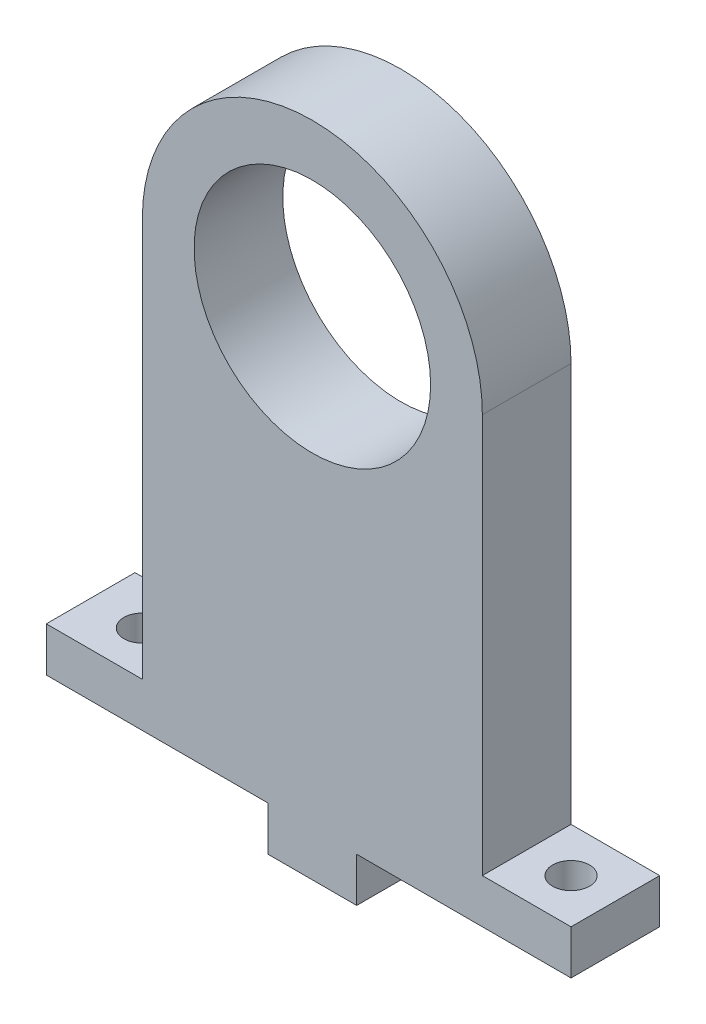
from build123d import *

# Parameters (mm, degrees)
SKETCH_1_R          = 8
EXTRUDE_1_DEPTH     = 6
SKETCH_2_R          = 1.25
CUT_EXTRUDE_1_DEPTH = 3


with BuildPart() as part:
    # 草图1 → 凸台-拉伸1 (new body)
    with BuildSketch(Plane.XY):
        with BuildLine():
            Line((-3, -30), (-18, -30))
            Line((-18, -30), (-18, -27))
            Line((-18, -27), (-11.5, -27))
            Line((-11.5, -27), (-11.5, 0))
            ThreePointArc((-11.5, 0), (0, 11.5), (11.5, 0))
            Line((11.5, 0), (11.5, -27))
            Line((11.5, -27), (17.5, -27))
            Line((17.5, -27), (17.5, -30))
            Line((17.5, -30), (3, -30))
            Line((3, -30), (3, -33))
            Line((3, -33), (0, -33))
            Line((0, -33), (-3, -33))
            Line((-3, -33), (-3, -30))
        make_face()
        Circle(SKETCH_1_R, mode=Mode.SUBTRACT)
    extrude(amount=EXTRUDE_1_DEPTH)

    # 草图2 → 切除-拉伸1 (cut)
    with BuildSketch(Plane(origin=(0, -27, 0), x_dir=(1, 0, 0), z_dir=(0, 1, 0))):
        with Locations(Location((-14.5, -3, 0), (0, 0, 270))):
            Circle(SKETCH_2_R)
        with Locations(Location((14.5, -3, 0), (0, 0, 270))):
            Circle(SKETCH_2_R)
    extrude(amount=-CUT_EXTRUDE_1_DEPTH, mode=Mode.SUBTRACT)


solid = part.part
